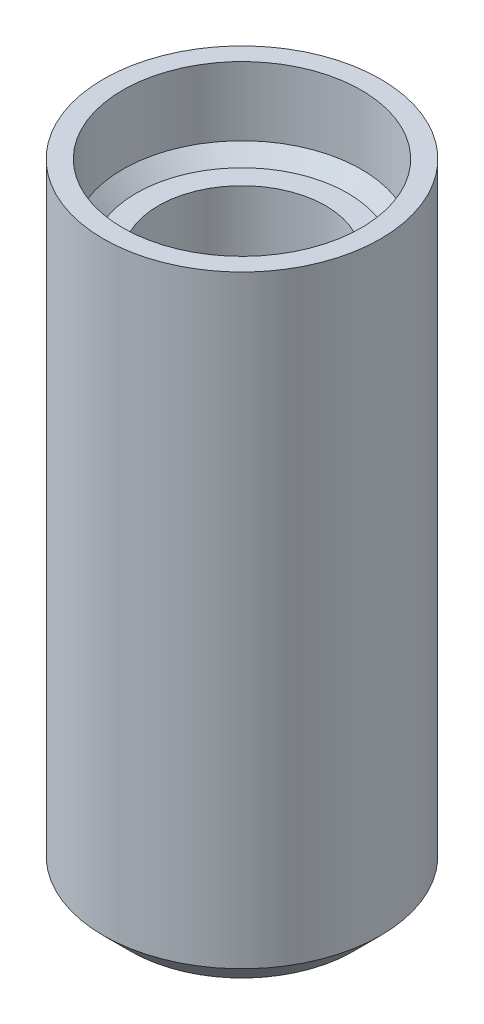
from build123d import *

# Parameters (mm, degrees)
SKETCH1_R           = 5.05
BOSS_EXTRUDE1_DEPTH = 20
SKETCH2_R           = 5.05
BOSS_EXTRUDE2_DEPTH = 2
SKETCH4_R           = 5.05
SKETCH4_R_2         = 4.35
BOSS_EXTRUDE3_DEPTH = 3
CHAMFER1_SIZE       = 1
CHAMFER2_SIZE       = 0.5
CUT_EXTRUDE1_DEPTH  = 0.4
BOSS_EXTRUDE4_DEPTH = 0.4


with BuildPart() as part:
    # Sketch1 → Boss-Extrude1 (new body)
    with BuildSketch(Plane(origin=(0, 0, 0), x_dir=(1, 0, 0), z_dir=(0, 1, 0))):
        Circle(SKETCH1_R)
        with BuildLine():
            Line((2.565151068, -1.65), (-2.565151068, -1.65))
            ThreePointArc((-2.565151068, -1.65), (0, 3.05), (2.565151068, -1.65))
        make_face(mode=Mode.SUBTRACT)
    extrude(amount=BOSS_EXTRUDE1_DEPTH)

    # Sketch2 → Boss-Extrude2 (add)
    with BuildSketch(Plane.XZ):
        Circle(SKETCH2_R)
    extrude(amount=-BOSS_EXTRUDE2_DEPTH)

    # Sketch4 → Boss-Extrude3 (add)
    with BuildSketch(Plane(origin=(0, 20, 0), x_dir=(1, 0, 0), z_dir=(0, 1, 0))):
        Circle(SKETCH4_R)
        Circle(SKETCH4_R_2, mode=Mode.SUBTRACT)
    extrude(amount=BOSS_EXTRUDE3_DEPTH)

    # Chamfer1
    chamfer1_edges = [part.edges().sort_by_distance(p)[0] for p in [
        (-5.05, 0, 0),
    ]]
    chamfer(chamfer1_edges, length=CHAMFER1_SIZE)

    # Chamfer2
    chamfer2_edges = [part.edges().sort_by_distance(p)[0] for p in [
        (-4.35, 20, 0),
    ]]
    chamfer(chamfer2_edges, length=CHAMFER2_SIZE)

    # Sketch5 → Cut-Extrude1 (cut)
    with BuildSketch(Plane.XZ):
        with BuildLine():
            add(Edge.make_bspline(
                [(1.503946302, -0.535052306), (1.502881459, -0.588771337), (1.500777939, -0.694889371), (1.481478336, -0.850881125), (1.449138002, -1.000979571), (1.405403718, -1.144625209), (1.350378927, -1.2810962), (1.279745049, -1.406718229), (1.200606075, -1.524449077), (1.107469966, -1.631043167), (1.003303489, -1.727416338), (0.887190607, -1.812515059), (0.760842534, -1.888418386), (0.622283687, -1.950602119), (0.473498466, -2.002898176), (0.312931114, -2.037608387), (0.141665136, -2.060658768), (0.023747375, -2.062862466), (-0.036998679, -2.063997715)],
                knots=[0, 0, 0, 0, 1.052094964, 2.078336987, 3.073525958, 4.056795553, 5.017248361, 5.94962998, 6.875194829, 7.791754631, 8.716005461, 9.649849497, 10.607389713, 11.598026182, 12.620271304, 13.691227089, 14.810621544, 16, 16, 16, 16], degree=3))
            add(Edge.make_bspline(
                [(-0.036998679, -2.063997715), (-0.086033156, -2.063393748), (-0.180954727, -2.062224582), (-0.318534943, -2.048587637), (-0.446777483, -2.028483092), (-0.565426114, -1.99815795), (-0.675287808, -1.960270037), (-0.776710239, -1.913753373), (-0.871480456, -1.86086851), (-0.958459535, -1.799747567), (-1.038057419, -1.731603056), (-1.108949447, -1.655894068), (-1.174022796, -1.574705077), (-1.229593722, -1.485238412), (-1.278224315, -1.389272789), (-1.323531217, -1.288817147), (-1.362540456, -1.181773637), (-1.408337951, -1.029262264), (-1.451141207, -0.824074868), (-1.484723301, -0.562930097), (-1.500159208, -0.283587676), (-1.502659978, -0.09174829), (-1.503946302, 0.006928343)],
                knots=[0, 0, 0, 0, 1.005033513, 1.945556776, 2.832059393, 3.664177915, 4.453103597, 5.211602499, 5.949119833, 6.675308483, 7.387697722, 8.093532862, 8.799070145, 9.517726285, 10.248275697, 11.003967447, 11.775895392, 12.582387437, 14.267390505, 16.066249085, 17.976592289, 20, 20, 20, 20], degree=3))
            add(Edge.make_bspline(
                [(-1.503946302, 0.006928343), (-1.502703471, 0.093615522), (-1.500157625, 0.271187615), (-1.481788253, 0.540842626), (-1.444960261, 0.814315862), (-1.394330256, 1.039834747), (-1.341217941, 1.216526694), (-1.29359256, 1.345831542), (-1.237667995, 1.471639768), (-1.17657832, 1.594730675), (-1.105916684, 1.712473838), (-1.025705858, 1.823265711), (-0.934930515, 1.925687113), (-0.834725077, 2.020873752), (-0.724625296, 2.108603649), (-0.60254118, 2.185508028), (-0.470194215, 2.253794213), (-0.326347326, 2.311808083), (-0.170126079, 2.359859555), (-2.9225e-05, 2.391436767), (0.183486815, 2.412080503), (0.310260823, 2.41455792), (0.375986575, 2.415842333)],
                knots=[0, 0, 0, 0, 1.491443386, 3.055108323, 4.647161893, 6.234581436, 7.025567321, 7.820286444, 8.60345859, 9.393383516, 10.183141888, 10.963158189, 11.743258812, 12.534265486, 13.338548608, 14.161046816, 15.012581643, 15.897544149, 16.826403745, 17.819517065, 18.869532616, 20, 20, 20, 20], degree=3))
            add(Edge.make_bspline(
                [(0.375986575, 2.415842333), (0.419016355, 2.415091458), (0.50557291, 2.413581034), (0.633998362, 2.400794134), (0.758549364, 2.383523068), (0.874136953, 2.360263565), (0.977379306, 2.336210608), (1.061947423, 2.305829106), (1.126199658, 2.279406157), (1.168268647, 2.25255887), (1.19513746, 2.227186074), (1.21019683, 2.198795048), (1.224410472, 2.169516476), (1.232104787, 2.135616198), (1.241670249, 2.09766429), (1.243982465, 2.051838869), (1.247737606, 1.997257764), (1.247878521, 1.957540028), (1.247955442, 1.935859471)],
                knots=[0, 0, 0, 0, 1.790819153, 3.602322331, 5.368404252, 7.022926428, 8.510406466, 9.774233699, 10.761844726, 11.392996174, 11.844328221, 12.279811468, 12.720786524, 13.19540678, 13.720669324, 14.347535504, 15.097976019, 16, 16, 16, 16], degree=3))
            add(Edge.make_bspline(
                [(1.247955442, 1.935859471), (1.247911639, 1.90285051), (1.247831955, 1.842802685), (1.243838348, 1.761757059), (1.238161995, 1.697535945), (1.226475285, 1.649271352), (1.210736381, 1.613571377), (1.188401159, 1.58978889), (1.16072396, 1.575606023), (1.140459432, 1.574464078), (1.129959655, 1.573872395)],
                knots=[0, 0, 0, 0, 1.888449276, 3.435348052, 4.644422216, 5.569671885, 6.269206351, 6.849327691, 7.40379549, 8, 8, 8, 8], degree=3))
            add(Edge.make_bspline(
                [(1.129959655, 1.573872395), (1.114538376, 1.575416304), (1.079116012, 1.578962631), (1.021265402, 1.597266415), (0.950807955, 1.620318848), (0.866703714, 1.647159192), (0.767301485, 1.67187518), (0.651728916, 1.694341658), (0.518038396, 1.70960905), (0.422697851, 1.711083315), (0.371986718, 1.711867468)],
                knots=[0, 0, 0, 0, 0.479331651, 1.101015033, 1.872171618, 2.780746856, 3.83579878, 5.045610707, 6.428575928, 8, 8, 8, 8], degree=3))
            add(Edge.make_bspline(
                [(0.371986718, 1.711867468), (0.328255027, 1.710798622), (0.24372821, 1.708732701), (0.122260741, 1.69060805), (0.010918822, 1.660914919), (-0.089598435, 1.618464667), (-0.180370588, 1.566422036), (-0.261232922, 1.504056535), (-0.334496972, 1.43467073), (-0.397837163, 1.355428749), (-0.452576019, 1.269323478), (-0.499980536, 1.176659284), (-0.539044444, 1.077155621), (-0.569416324, 0.971176475), (-0.593580932, 0.859936693), (-0.610021695, 0.743929398), (-0.621443757, 0.623120784), (-0.623782022, 0.540935777), (-0.624977685, 0.498910777)],
                knots=[0, 0, 0, 0, 1.177742439, 2.276399977, 3.300389835, 4.274485222, 5.207989402, 6.111505077, 7.019828615, 7.920303948, 8.837112545, 9.76494003, 10.720560743, 11.712421005, 12.732346221, 13.785268587, 14.867505249, 16, 16, 16, 16], degree=3))
            add(Edge.make_bspline(
                [(-0.624977685, 0.498910777), (-0.598815296, 0.514875575), (-0.543755603, 0.54847407), (-0.454338206, 0.594696655), (-0.355888056, 0.639396798), (-0.247145356, 0.675798167), (-0.130181887, 0.706601472), (-0.004438798, 0.7317549), (0.13014859, 0.749840102), (0.223262418, 0.751203102), (0.270990324, 0.751901744)],
                knots=[0, 0, 0, 0, 0.779327225, 1.640122279, 2.558603002, 3.526465564, 4.55261428, 5.633346691, 6.786910502, 8, 8, 8, 8], degree=3))
            add(Edge.make_bspline(
                [(0.270990324, 0.751901744), (0.323706615, 0.750771237), (0.425429214, 0.748589785), (0.571959816, 0.731360287), (0.70718062, 0.704044118), (0.830694767, 0.66374407), (0.943166689, 0.613580777), (1.045712044, 0.554791347), (1.135984989, 0.483834943), (1.216554618, 0.404391731), (1.287587279, 0.315924918), (1.345878635, 0.216866963), (1.396677558, 0.110402972), (1.436080664, -0.005232629), (1.466877309, -0.128032268), (1.488751559, -0.257752651), (1.502000853, -0.394110944), (1.503287946, -0.487356582), (1.503946302, -0.535052306)],
                knots=[0, 0, 0, 0, 1.239751886, 2.392254473, 3.465624754, 4.479769077, 5.441484179, 6.358632481, 7.25263028, 8.134197614, 9.015869549, 9.912785271, 10.831741688, 11.78643114, 12.781018179, 13.807095441, 14.878315683, 16, 16, 16, 16], degree=3))
        make_face()
        with BuildLine():
            add(Edge.make_bspline(
                [(0.607978292, -0.624049128), (0.607047358, -0.572269039), (0.605300679, -0.475115857), (0.581855783, -0.33926717), (0.545472325, -0.221703119), (0.488531292, -0.123442834), (0.410942388, -0.044721691), (0.328788077, -0.000456186), (0.25486156, 0.024317965), (0.192579111, 0.038403937), (0.124187402, 0.046079797), (0.076682477, 0.04729529), (0.051998143, 0.047926879)],
                knots=[0, 0, 0, 0, 1.544136591, 2.897209858, 4.102556162, 5.200035191, 6.255607157, 7.360461559, 7.948979087, 8.581539878, 9.262944991, 10, 10, 10, 10], degree=3))
            add(Edge.make_bspline(
                [(0.051998143, 0.047926879), (0.021956963, 0.047174578), (-0.038030863, 0.045672344), (-0.126958011, 0.033036272), (-0.214540293, 0.014015642), (-0.299800076, -0.011765556), (-0.382600031, -0.044130807), (-0.461385904, -0.081968221), (-0.536924826, -0.122893764), (-0.584476381, -0.153124266), (-0.607978292, -0.168065409)],
                knots=[0, 0, 0, 0, 1.023182102, 2.043144358, 3.054534018, 4.074938816, 5.074654996, 6.080545499, 7.051327576, 8, 8, 8, 8], degree=3))
            add(Edge.make_bspline(
                [(-0.607978292, -0.168065409), (-0.607841017, -0.223411252), (-0.607578706, -0.329168757), (-0.598890081, -0.480547345), (-0.587612177, -0.617738928), (-0.570839189, -0.741303574), (-0.548908088, -0.851461884), (-0.523140695, -0.949541283), (-0.492627398, -1.035842336), (-0.456497104, -1.110671582), (-0.415757745, -1.174761754), (-0.368421459, -1.227103062), (-0.319026691, -1.272333229), (-0.262581822, -1.305746499), (-0.20140863, -1.329236919), (-0.136286254, -1.347903868), (-0.065928748, -1.357258258), (-0.017686989, -1.359087019), (0.00699975, -1.36002285)],
                knots=[0, 0, 0, 0, 1.750429098, 3.344804261, 4.794861443, 6.104100456, 7.286908508, 8.345779056, 9.309674924, 10.177362526, 10.969917035, 11.701946289, 12.404210742, 13.080507119, 13.761880499, 14.473033236, 15.218605803, 16, 16, 16, 16], degree=3))
            add(Edge.make_bspline(
                [(0.00699975, -1.36002285), (0.031053957, -1.359666204), (0.078101395, -1.358968644), (0.146005666, -1.347146955), (0.209700036, -1.330762252), (0.286836738, -1.298401368), (0.374429914, -1.24311907), (0.459573966, -1.151258363), (0.525373547, -1.040714663), (0.573349823, -0.914180532), (0.602452107, -0.773347461), (0.606097727, -0.674855475), (0.607978292, -0.624049128)],
                knots=[0, 0, 0, 0, 0.673288761, 1.316880279, 1.92655057, 2.513013161, 3.655971931, 4.799388861, 5.989931897, 7.240969136, 8.576774776, 10, 10, 10, 10], degree=3))
        make_face(mode=Mode.SUBTRACT)
    extrude(amount=-CUT_EXTRUDE1_DEPTH, mode=Mode.SUBTRACT)


with BuildPart() as body_2:
    # Sketch5<2> → Boss-Extrude4 (new body)
    with BuildSketch(Plane.XZ):
        with BuildLine():
            add(Edge.make_bspline(
                [(1.503946302, -0.535052306), (1.502881459, -0.588771337), (1.500777939, -0.694889371), (1.481478336, -0.850881125), (1.449138002, -1.000979571), (1.405403718, -1.144625209), (1.350378927, -1.2810962), (1.279745049, -1.406718229), (1.200606075, -1.524449077), (1.107469966, -1.631043167), (1.003303489, -1.727416338), (0.887190607, -1.812515059), (0.760842534, -1.888418386), (0.622283687, -1.950602119), (0.473498466, -2.002898176), (0.312931114, -2.037608387), (0.141665136, -2.060658768), (0.023747375, -2.062862466), (-0.036998679, -2.063997715)],
                knots=[0, 0, 0, 0, 1.052094964, 2.078336987, 3.073525958, 4.056795553, 5.017248361, 5.94962998, 6.875194829, 7.791754631, 8.716005461, 9.649849497, 10.607389713, 11.598026182, 12.620271304, 13.691227089, 14.810621544, 16, 16, 16, 16], degree=3))
            add(Edge.make_bspline(
                [(-0.036998679, -2.063997715), (-0.086033156, -2.063393748), (-0.180954727, -2.062224582), (-0.318534943, -2.048587637), (-0.446777483, -2.028483092), (-0.565426114, -1.99815795), (-0.675287808, -1.960270037), (-0.776710239, -1.913753373), (-0.871480456, -1.86086851), (-0.958459535, -1.799747567), (-1.038057419, -1.731603056), (-1.108949447, -1.655894068), (-1.174022796, -1.574705077), (-1.229593722, -1.485238412), (-1.278224315, -1.389272789), (-1.323531217, -1.288817147), (-1.362540456, -1.181773637), (-1.408337951, -1.029262264), (-1.451141207, -0.824074868), (-1.484723301, -0.562930097), (-1.500159208, -0.283587676), (-1.502659978, -0.09174829), (-1.503946302, 0.006928343)],
                knots=[0, 0, 0, 0, 1.005033513, 1.945556776, 2.832059393, 3.664177915, 4.453103597, 5.211602499, 5.949119833, 6.675308483, 7.387697722, 8.093532862, 8.799070145, 9.517726285, 10.248275697, 11.003967447, 11.775895392, 12.582387437, 14.267390505, 16.066249085, 17.976592289, 20, 20, 20, 20], degree=3))
            add(Edge.make_bspline(
                [(-1.503946302, 0.006928343), (-1.502703471, 0.093615522), (-1.500157625, 0.271187615), (-1.481788253, 0.540842626), (-1.444960261, 0.814315862), (-1.394330256, 1.039834747), (-1.341217941, 1.216526694), (-1.29359256, 1.345831542), (-1.237667995, 1.471639768), (-1.17657832, 1.594730675), (-1.105916684, 1.712473838), (-1.025705858, 1.823265711), (-0.934930515, 1.925687113), (-0.834725077, 2.020873752), (-0.724625296, 2.108603649), (-0.60254118, 2.185508028), (-0.470194215, 2.253794213), (-0.326347326, 2.311808083), (-0.170126079, 2.359859555), (-2.9225e-05, 2.391436767), (0.183486815, 2.412080503), (0.310260823, 2.41455792), (0.375986575, 2.415842333)],
                knots=[0, 0, 0, 0, 1.491443386, 3.055108323, 4.647161893, 6.234581436, 7.025567321, 7.820286444, 8.60345859, 9.393383516, 10.183141888, 10.963158189, 11.743258812, 12.534265486, 13.338548608, 14.161046816, 15.012581643, 15.897544149, 16.826403745, 17.819517065, 18.869532616, 20, 20, 20, 20], degree=3))
            add(Edge.make_bspline(
                [(0.375986575, 2.415842333), (0.419016355, 2.415091458), (0.50557291, 2.413581034), (0.633998362, 2.400794134), (0.758549364, 2.383523068), (0.874136953, 2.360263565), (0.977379306, 2.336210608), (1.061947423, 2.305829106), (1.126199658, 2.279406157), (1.168268647, 2.25255887), (1.19513746, 2.227186074), (1.21019683, 2.198795048), (1.224410472, 2.169516476), (1.232104787, 2.135616198), (1.241670249, 2.09766429), (1.243982465, 2.051838869), (1.247737606, 1.997257764), (1.247878521, 1.957540028), (1.247955442, 1.935859471)],
                knots=[0, 0, 0, 0, 1.790819153, 3.602322331, 5.368404252, 7.022926428, 8.510406466, 9.774233699, 10.761844726, 11.392996174, 11.844328221, 12.279811468, 12.720786524, 13.19540678, 13.720669324, 14.347535504, 15.097976019, 16, 16, 16, 16], degree=3))
            add(Edge.make_bspline(
                [(1.247955442, 1.935859471), (1.247911639, 1.90285051), (1.247831955, 1.842802685), (1.243838348, 1.761757059), (1.238161995, 1.697535945), (1.226475285, 1.649271352), (1.210736381, 1.613571377), (1.188401159, 1.58978889), (1.16072396, 1.575606023), (1.140459432, 1.574464078), (1.129959655, 1.573872395)],
                knots=[0, 0, 0, 0, 1.888449276, 3.435348052, 4.644422216, 5.569671885, 6.269206351, 6.849327691, 7.40379549, 8, 8, 8, 8], degree=3))
            add(Edge.make_bspline(
                [(1.129959655, 1.573872395), (1.114538376, 1.575416304), (1.079116012, 1.578962631), (1.021265402, 1.597266415), (0.950807955, 1.620318848), (0.866703714, 1.647159192), (0.767301485, 1.67187518), (0.651728916, 1.694341658), (0.518038396, 1.70960905), (0.422697851, 1.711083315), (0.371986718, 1.711867468)],
                knots=[0, 0, 0, 0, 0.479331651, 1.101015033, 1.872171618, 2.780746856, 3.83579878, 5.045610707, 6.428575928, 8, 8, 8, 8], degree=3))
            add(Edge.make_bspline(
                [(0.371986718, 1.711867468), (0.328255027, 1.710798622), (0.24372821, 1.708732701), (0.122260741, 1.69060805), (0.010918822, 1.660914919), (-0.089598435, 1.618464667), (-0.180370588, 1.566422036), (-0.261232922, 1.504056535), (-0.334496972, 1.43467073), (-0.397837163, 1.355428749), (-0.452576019, 1.269323478), (-0.499980536, 1.176659284), (-0.539044444, 1.077155621), (-0.569416324, 0.971176475), (-0.593580932, 0.859936693), (-0.610021695, 0.743929398), (-0.621443757, 0.623120784), (-0.623782022, 0.540935777), (-0.624977685, 0.498910777)],
                knots=[0, 0, 0, 0, 1.177742439, 2.276399977, 3.300389835, 4.274485222, 5.207989402, 6.111505077, 7.019828615, 7.920303948, 8.837112545, 9.76494003, 10.720560743, 11.712421005, 12.732346221, 13.785268587, 14.867505249, 16, 16, 16, 16], degree=3))
            add(Edge.make_bspline(
                [(-0.624977685, 0.498910777), (-0.598815296, 0.514875575), (-0.543755603, 0.54847407), (-0.454338206, 0.594696655), (-0.355888056, 0.639396798), (-0.247145356, 0.675798167), (-0.130181887, 0.706601472), (-0.004438798, 0.7317549), (0.13014859, 0.749840102), (0.223262418, 0.751203102), (0.270990324, 0.751901744)],
                knots=[0, 0, 0, 0, 0.779327225, 1.640122279, 2.558603002, 3.526465564, 4.55261428, 5.633346691, 6.786910502, 8, 8, 8, 8], degree=3))
            add(Edge.make_bspline(
                [(0.270990324, 0.751901744), (0.323706615, 0.750771237), (0.425429214, 0.748589785), (0.571959816, 0.731360287), (0.70718062, 0.704044118), (0.830694767, 0.66374407), (0.943166689, 0.613580777), (1.045712044, 0.554791347), (1.135984989, 0.483834943), (1.216554618, 0.404391731), (1.287587279, 0.315924918), (1.345878635, 0.216866963), (1.396677558, 0.110402972), (1.436080664, -0.005232629), (1.466877309, -0.128032268), (1.488751559, -0.257752651), (1.502000853, -0.394110944), (1.503287946, -0.487356582), (1.503946302, -0.535052306)],
                knots=[0, 0, 0, 0, 1.239751886, 2.392254473, 3.465624754, 4.479769077, 5.441484179, 6.358632481, 7.25263028, 8.134197614, 9.015869549, 9.912785271, 10.831741688, 11.78643114, 12.781018179, 13.807095441, 14.878315683, 16, 16, 16, 16], degree=3))
        make_face()
        with BuildLine():
            add(Edge.make_bspline(
                [(0.607978292, -0.624049128), (0.607047358, -0.572269039), (0.605300679, -0.475115857), (0.581855783, -0.33926717), (0.545472325, -0.221703119), (0.488531292, -0.123442834), (0.410942388, -0.044721691), (0.328788077, -0.000456186), (0.25486156, 0.024317965), (0.192579111, 0.038403937), (0.124187402, 0.046079797), (0.076682477, 0.04729529), (0.051998143, 0.047926879)],
                knots=[0, 0, 0, 0, 1.544136591, 2.897209858, 4.102556162, 5.200035191, 6.255607157, 7.360461559, 7.948979087, 8.581539878, 9.262944991, 10, 10, 10, 10], degree=3))
            add(Edge.make_bspline(
                [(0.051998143, 0.047926879), (0.021956963, 0.047174578), (-0.038030863, 0.045672344), (-0.126958011, 0.033036272), (-0.214540293, 0.014015642), (-0.299800076, -0.011765556), (-0.382600031, -0.044130807), (-0.461385904, -0.081968221), (-0.536924826, -0.122893764), (-0.584476381, -0.153124266), (-0.607978292, -0.168065409)],
                knots=[0, 0, 0, 0, 1.023182102, 2.043144358, 3.054534018, 4.074938816, 5.074654996, 6.080545499, 7.051327576, 8, 8, 8, 8], degree=3))
            add(Edge.make_bspline(
                [(-0.607978292, -0.168065409), (-0.607841017, -0.223411252), (-0.607578706, -0.329168757), (-0.598890081, -0.480547345), (-0.587612177, -0.617738928), (-0.570839189, -0.741303574), (-0.548908088, -0.851461884), (-0.523140695, -0.949541283), (-0.492627398, -1.035842336), (-0.456497104, -1.110671582), (-0.415757745, -1.174761754), (-0.368421459, -1.227103062), (-0.319026691, -1.272333229), (-0.262581822, -1.305746499), (-0.20140863, -1.329236919), (-0.136286254, -1.347903868), (-0.065928748, -1.357258258), (-0.017686989, -1.359087019), (0.00699975, -1.36002285)],
                knots=[0, 0, 0, 0, 1.750429098, 3.344804261, 4.794861443, 6.104100456, 7.286908508, 8.345779056, 9.309674924, 10.177362526, 10.969917035, 11.701946289, 12.404210742, 13.080507119, 13.761880499, 14.473033236, 15.218605803, 16, 16, 16, 16], degree=3))
            add(Edge.make_bspline(
                [(0.00699975, -1.36002285), (0.031053957, -1.359666204), (0.078101395, -1.358968644), (0.146005666, -1.347146955), (0.209700036, -1.330762252), (0.286836738, -1.298401368), (0.374429914, -1.24311907), (0.459573966, -1.151258363), (0.525373547, -1.040714663), (0.573349823, -0.914180532), (0.602452107, -0.773347461), (0.606097727, -0.674855475), (0.607978292, -0.624049128)],
                knots=[0, 0, 0, 0, 0.673288761, 1.316880279, 1.92655057, 2.513013161, 3.655971931, 4.799388861, 5.989931897, 7.240969136, 8.576774776, 10, 10, 10, 10], degree=3))
        make_face(mode=Mode.SUBTRACT)
    extrude(amount=-BOSS_EXTRUDE4_DEPTH)


solid = Compound([part.part, body_2.part])
